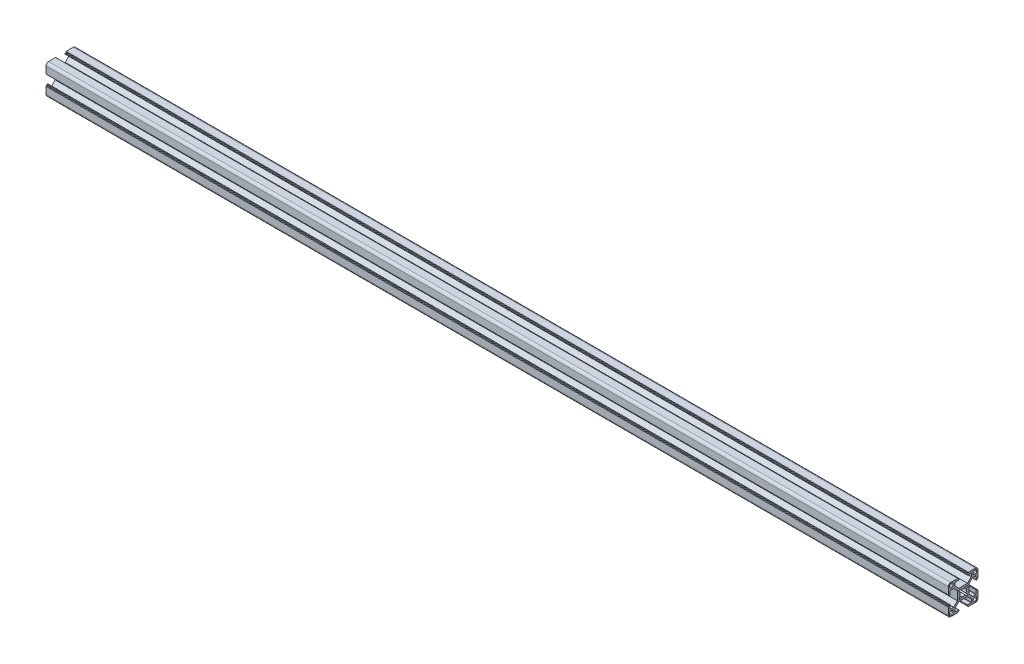
from build123d import *

# Parameters (mm, degrees)
SKETCH2_W                = 30
SKETCH2_H                = 30
BOSS_EXTRUDE1_DEPTH      = 910
SKETCH5_R                = 3.4
CUT_EXTRUDE2_DEPTH       = 911.247219166
CUT_EXTRUDE1_DEPTH       = 911.247219166
FILLET1_R                = 2.5
FILLET2_R                = 0.3
CIRPATTERN1_COUNT        = 4
FILLET1_OF_CIRPATTERN1_R = 2.5
FILLET2_OF_CIRPATTERN1_R = 0.3


with BuildPart() as part:
    # Sketch2 → Boss-Extrude1 (new body)
    with BuildSketch(Plane(origin=(0, 0, 0), x_dir=(0, 0, -1), z_dir=(1, 0, 0))):
        Rectangle(SKETCH2_W, SKETCH2_H)
    extrude(amount=BOSS_EXTRUDE1_DEPTH)

    # Sketch5 → Cut-Extrude2 (cut, through all)
    with BuildSketch(Plane(origin=(910, 0, 0), x_dir=(0, 0, -1), z_dir=(1, 0, 0))):
        Circle(SKETCH5_R)
    extrude(amount=-CUT_EXTRUDE2_DEPTH, mode=Mode.SUBTRACT)

    # Sketch4 → Cut-Extrude1 (cut, through all)
    with BuildSketch(Plane(origin=(910, 0, 0), x_dir=(0, 0, -1), z_dir=(1, 0, 0))):
        with BuildLine():
            Line((-4.385786454, -5.8), (4.385786454, -5.8))
            Line((4.385786454, -5.8), (8.162132034, -9.57634558))
            ThreePointArc((8.162132034, -9.57634558), (8.22716386, -9.673672585), (8.25, -9.788477614))
            Line((8.25, -9.788477614), (8.25, -13))
            Line((8.25, -13), (4.1, -13))
            Line((4.1, -13), (4.1, -14))
            Line((4.1, -14), (5.1, -14))
            Line((5.1, -14), (5.1, -15))
            Line((5.1, -15), (-5.1, -15))
            Line((-5.1, -15), (-5.1, -14))
            Line((-5.1, -14), (-4.1, -14))
            Line((-4.1, -14), (-4.1, -13))
            Line((-4.1, -13), (-8.25, -13))
            Line((-8.25, -13), (-8.25, -9.788477614))
            ThreePointArc((-8.25, -9.788477614), (-8.22716386, -9.673672585), (-8.162132034, -9.57634558))
            Line((-8.162132034, -9.57634558), (-4.385786454, -5.8))
        make_face()
        with BuildLine():
            Line((11.05, -10.05), (12.65, -10.05))
            ThreePointArc((12.65, -10.05), (13.357106781, -10.342893219), (13.65, -11.05))
            Line((13.65, -11.05), (13.65, -12.65))
            ThreePointArc((13.65, -12.65), (13.357106781, -13.357106781), (12.65, -13.65))
            Line((12.65, -13.65), (11.05, -13.65))
            ThreePointArc((11.05, -13.65), (10.342893219, -13.357106781), (10.05, -12.65))
            Line((10.05, -12.65), (10.05, -11.05))
            ThreePointArc((10.05, -11.05), (10.342893219, -10.342893219), (11.05, -10.05))
        make_face()
        with BuildLine():
            Line((4.065863992, -3.00520382), (2.87527145, -1.814611278))
            ThreePointArc((2.87527145, -1.814611278), (2.404163056, -2.404163056), (1.814611278, -2.87527145))
            Line((1.814611278, -2.87527145), (3.00520382, -4.065863992))
            ThreePointArc((3.00520382, -4.065863992), (4.065863992, -4.065863992), (4.065863992, -3.00520382))
        make_face()
    cut_extrude1 = extrude(amount=-CUT_EXTRUDE1_DEPTH, mode=Mode.SUBTRACT)

    # Fillet1
    fillet1_edges = [part.edges().sort_by_distance(p)[0] for p in [
        (455, -15, -15),
    ]]
    fillet(fillet1_edges, radius=FILLET1_R)

    # Fillet2
    fillet2_edges = [part.edges().sort_by_distance(p)[0] for p in [
        (455, -14, -5.1),
        (455, -15, -5.1),
        (455, -14, -4.1),
        (455, -13, -4.1),
        (455, -13, -8.25),
        (455, -13, 8.25),
        (455, -13, 4.1),
        (455, -14, 4.1),
        (455, -14, 5.1),
        (455, -15, 5.1),
    ]]
    fillet(fillet2_edges, radius=FILLET2_R)

    # CirPattern1: Cut-Extrude1 ×4 about axis
    cirpattern1_axis = Axis((0, 0, 0), (1, 0, 0))
    for i in range(1, CIRPATTERN1_COUNT):
        add(cut_extrude1.rotate(cirpattern1_axis, i * 360 / CIRPATTERN1_COUNT), mode=Mode.SUBTRACT)

    # Fillet1 of CirPattern1
    fillet1_of_cirpattern1_edges = [part.edges().sort_by_distance(p)[0] for p in [
        (455, 15, -15),
        (455, 15, 15),
        (455, -15, 15),
    ]]
    fillet(fillet1_of_cirpattern1_edges, radius=FILLET1_OF_CIRPATTERN1_R)

    # Fillet2 of CirPattern1
    fillet2_of_cirpattern1_edges = [part.edges().sort_by_distance(p)[0] for p in [
        (455, 5.1, -14),
        (455, 5.1, -15),
        (455, 4.1, -14),
        (455, 4.1, -13),
        (455, 8.25, -13),
        (455, -8.25, -13),
        (455, -4.1, -13),
        (455, -4.1, -14),
        (455, -5.1, -14),
        (455, -5.1, -15),
        (455, 14, 5.1),
        (455, 15, 5.1),
        (455, 14, 4.1),
        (455, 13, 4.1),
        (455, 13, 8.25),
        (455, 13, -8.25),
        (455, 13, -4.1),
        (455, 14, -4.1),
        (455, 14, -5.1),
        (455, 15, -5.1),
        (455, -5.1, 14),
        (455, -5.1, 15),
        (455, -4.1, 14),
        (455, -4.1, 13),
        (455, -8.25, 13),
        (455, 8.25, 13),
        (455, 4.1, 13),
        (455, 4.1, 14),
        (455, 5.1, 14),
        (455, 5.1, 15),
    ]]
    fillet(fillet2_of_cirpattern1_edges, radius=FILLET2_OF_CIRPATTERN1_R)


solid = part.part
